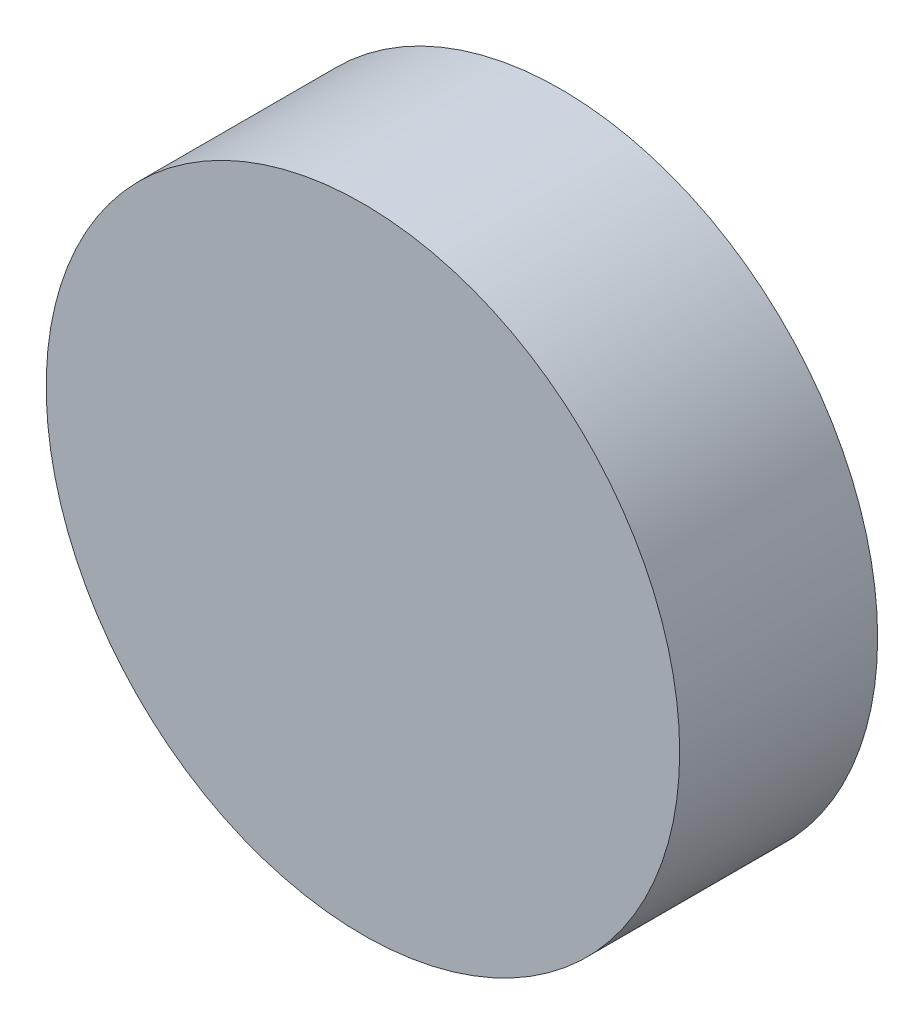
from build123d import *

# Parameters (mm, degrees)
SKETCH_1_R        = 8
PITCH_MOTOR_DEPTH = 5


with BuildPart() as part:
    # 草图1 → Pitch_Motor (new body)
    with BuildSketch(Plane.XY):
        Circle(SKETCH_1_R)
    extrude(amount=PITCH_MOTOR_DEPTH)


solid = part.part
